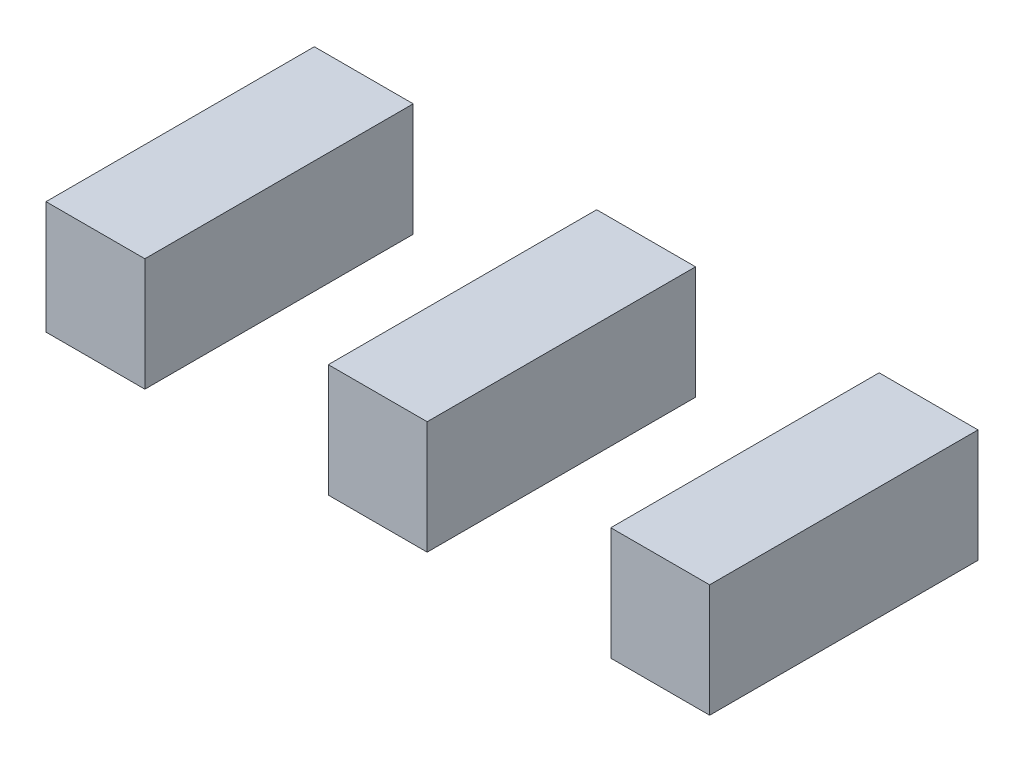
from build123d import *

# Parameters (mm, degrees)
SKETCH1_W             = 7
SKETCH1_H             = 19
BOSS_EXTRUDE1_DEPTH   = 8
BOSS_EXTRUDE1_2_DEPTH = 8
BOSS_EXTRUDE1_3_DEPTH = 8


with BuildPart() as part:
    # Sketch1 → Boss-Extrude1 (new body)
    with BuildSketch(Plane(origin=(0, 0, 0), x_dir=(1, 0, 0), z_dir=(0, 1, 0))):
        Rectangle(SKETCH1_W, SKETCH1_H)
    extrude(amount=BOSS_EXTRUDE1_DEPTH)


with BuildPart() as body_2:
    # Sketch1 → Boss-Extrude1 2 (new body)
    with BuildSketch(Plane(origin=(0, 0, 0), x_dir=(1, 0, 0), z_dir=(0, 1, 0))):
        with Locations((20, 0)):
            Rectangle(SKETCH1_W, SKETCH1_H)
    extrude(amount=BOSS_EXTRUDE1_2_DEPTH)


with BuildPart() as body_3:
    # Sketch1 → Boss-Extrude1 3 (new body)
    with BuildSketch(Plane(origin=(0, 0, 0), x_dir=(1, 0, 0), z_dir=(0, 1, 0))):
        with Locations((-19.987765385, 0)):
            Rectangle(SKETCH1_W, SKETCH1_H)
    extrude(amount=BOSS_EXTRUDE1_3_DEPTH)


solid = Compound([part.part, body_2.part, body_3.part])
